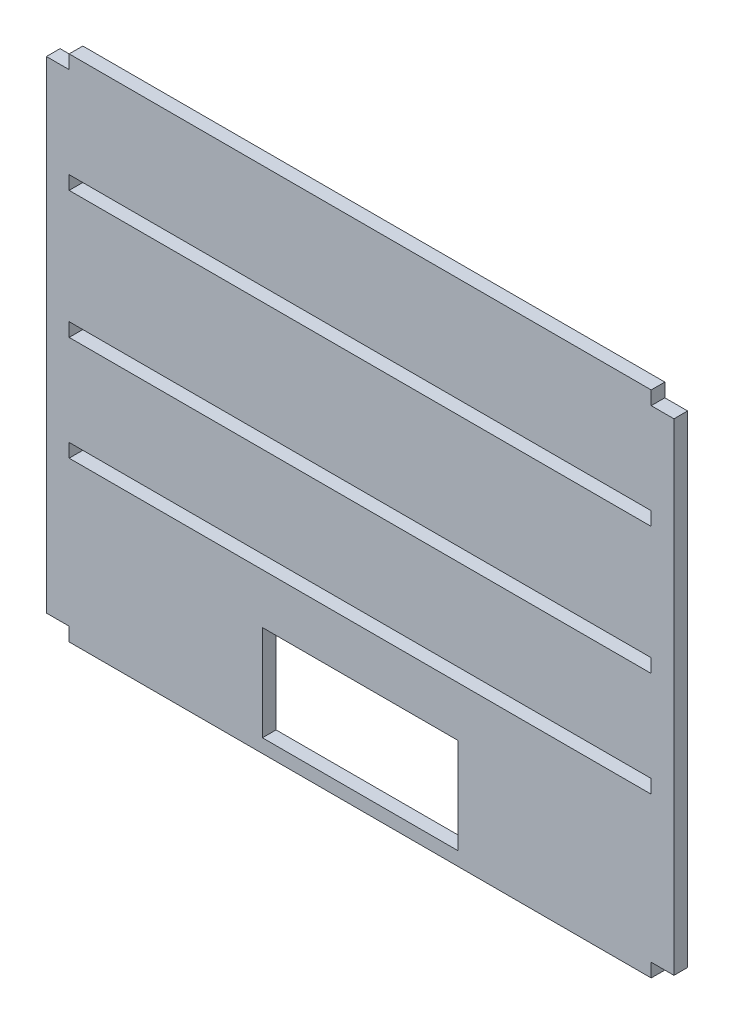
from build123d import *

# Parameters (mm, degrees)
SKETCH1_W           = 43
SKETCH1_H           = 21
SKETCH1_W_2         = 128
SKETCH1_H_2         = 3
BOSS_EXTRUDE2_DEPTH = 3


with BuildPart() as part:
    # Sketch1 → Boss-Extrude2 (new body)
    with BuildSketch(Plane.XY):
        Polygon((-95, -17.206125284), (33, -17.206125284), (33, -14.206125284), (38, -14.206125284), (38, 91.793874716), (33, 91.793874716), (33, 94.793874716), (-95, 94.793874716), (-95, 91.793874716), (-100, 91.793874716), (-100, -14.206125284), (-95, -14.206125284), align=None)
        with Locations((-31, -3.706125284)):
            Rectangle(SKETCH1_W, SKETCH1_H, mode=Mode.SUBTRACT)
        with Locations((-31, 19.293874716)):
            Rectangle(SKETCH1_W_2, SKETCH1_H_2, mode=Mode.SUBTRACT)
        with Locations((-31, 42.293874716)):
            Rectangle(SKETCH1_W_2, SKETCH1_H_2, mode=Mode.SUBTRACT)
        with Locations((-31, 70.293874716)):
            Rectangle(SKETCH1_W_2, SKETCH1_H_2, mode=Mode.SUBTRACT)
    extrude(amount=BOSS_EXTRUDE2_DEPTH)


solid = part.part
